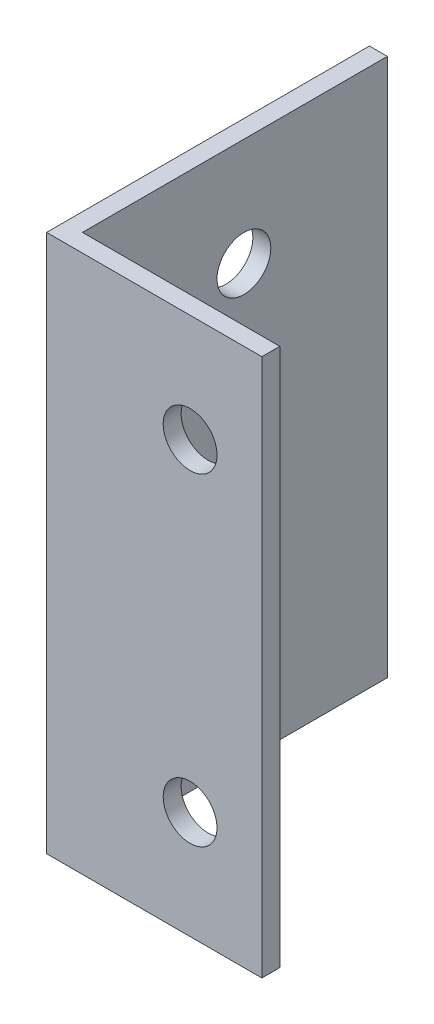
from build123d import *

# Parameters (mm, degrees)
EXTRUDE_2_DEPTH     = 30
SKETCH_5_R          = 1.5
CUT_EXTRUDE_3_DEPTH = 37.510272527
SKETCH_6_R          = 1.5
CUT_EXTRUDE_4_DEPTH = 37.674241642


with BuildPart() as part:
    # 草图4 → 凸台-拉伸2 (new body)
    with BuildSketch(Plane(origin=(0, 0, 0), x_dir=(1, 0, 0), z_dir=(0, 1, 0))):
        Polygon((0, 0), (0, 18), (1, 18), (1, 1), (12, 1), (12, 0), align=None)
    extrude(amount=EXTRUDE_2_DEPTH)

    # 草图5 → 切除-拉伸3 (cut, through all)
    with BuildSketch(Plane(origin=(0, 0, -1), x_dir=(-1, 0, 0), z_dir=(0, 0, -1))):
        with Locations((-8, 6)):
            Circle(SKETCH_5_R)
        with Locations(Location((-8, 24, 0), (0, 0, 180))):
            Circle(SKETCH_5_R)
    extrude(amount=-CUT_EXTRUDE_3_DEPTH, mode=Mode.SUBTRACT)

    # 草图6 → 切除-拉伸4 (cut, through all)
    with BuildSketch(Plane(origin=(1, 0, 0), x_dir=(0, 0, -1), z_dir=(1, 0, 0))):
        with Locations((10, 24)):
            Circle(SKETCH_6_R)
        with Locations(Location((10, 6, 0), (0, 0, 180))):
            Circle(SKETCH_6_R)
    extrude(amount=-CUT_EXTRUDE_4_DEPTH, mode=Mode.SUBTRACT)


solid = part.part
